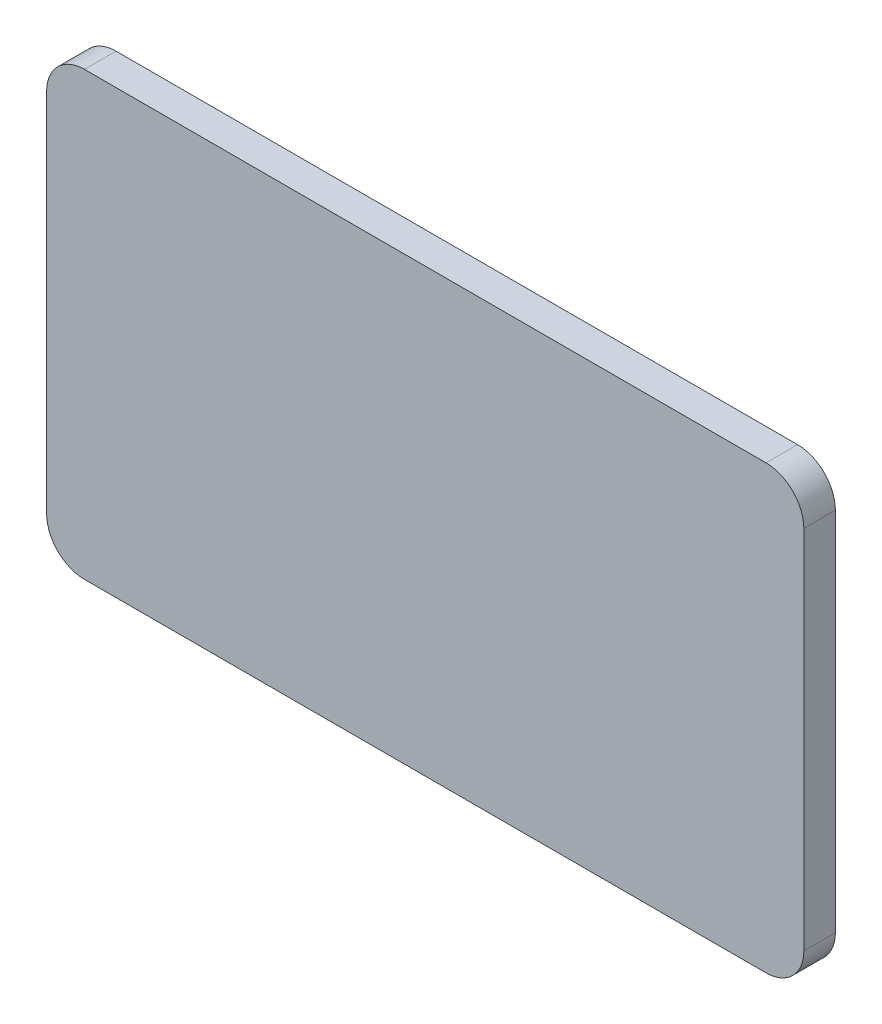
from build123d import *

# Parameters (mm, degrees)
BOSS_EXTRUDE1_DEPTH = 2.5


with BuildPart() as part:
    # Sketch1 → Boss-Extrude1 (new body)
    with BuildSketch(Plane.XY):
        with BuildLine():
            Line((-27, -17.5), (27, -17.5))
            ThreePointArc((27, -17.5), (29.121320344, -16.621320344), (30, -14.5))
            Line((30, -14.5), (30, 14.5))
            ThreePointArc((30, 14.5), (29.121320344, 16.621320344), (27, 17.5))
            Line((27, 17.5), (-27, 17.5))
            ThreePointArc((-27, 17.5), (-29.121320344, 16.621320344), (-30, 14.5))
            Line((-30, 14.5), (-30, -14.5))
            ThreePointArc((-30, -14.5), (-29.121320344, -16.621320344), (-27, -17.5))
        make_face()
    extrude(amount=BOSS_EXTRUDE1_DEPTH)


solid = part.part
